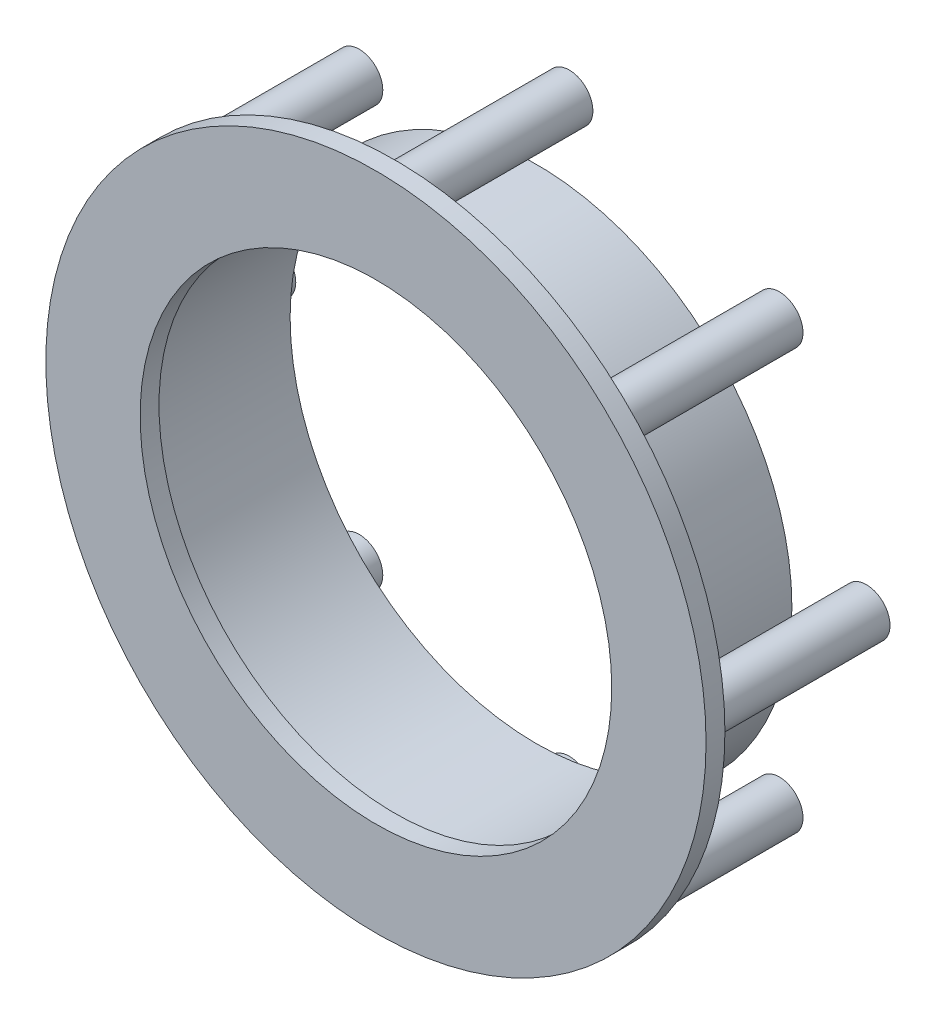
from build123d import *

# Parameters (mm, degrees)
CROQUIS1_R              = 35
CROQUIS1_R_2            = 25
SALIENTE_EXTRUIR1_DEPTH = 2
CROQUIS2_R              = 27.1
CROQUIS2_R_2            = 26.1
SALIENTE_EXTRUIR3_DEPTH = 15
CROQUIS5_R              = 2.5
SALIENTE_EXTRUIR5_DEPTH = 18.5


with BuildPart() as part:
    # Croquis1 → Saliente-Extruir1 (new body)
    with BuildSketch(Plane.XY):
        Circle(CROQUIS1_R)
        Circle(CROQUIS1_R_2, mode=Mode.SUBTRACT)
    extrude(amount=SALIENTE_EXTRUIR1_DEPTH)

    # Croquis2 → Saliente-Extruir3 (add)
    with BuildSketch(Plane(origin=(0, 0, 0), x_dir=(-1, 0, 0), z_dir=(0, 0, -1))):
        with Locations(Location((0, 0, 0), (0, 0, 180))):
            Circle(CROQUIS2_R)
        Circle(CROQUIS2_R_2, mode=Mode.SUBTRACT)
    extrude(amount=SALIENTE_EXTRUIR3_DEPTH)

    # Croquis5 → Saliente-Extruir5 (add)
    with BuildSketch(Plane(origin=(0, 0, 0), x_dir=(-1, 0, 0), z_dir=(0, 0, -1))):
        with Locations(Location((31.5, 0, 0), (0, 0, 180))):
            Circle(CROQUIS5_R)
        with Locations(Location((22.273863607, -22.273863607, 0), (0, 0, 180))):
            Circle(CROQUIS5_R)
        with Locations(Location((0, -31.5, 0), (0, 0, 180))):
            Circle(CROQUIS5_R)
        with Locations(Location((-22.273863607, -22.273863607, 0), (0, 0, 180))):
            Circle(CROQUIS5_R)
        with Locations(Location((-31.5, 0, 0), (0, 0, 180))):
            Circle(CROQUIS5_R)
        with Locations(Location((-22.273863607, 22.273863607, 0), (0, 0, 180))):
            Circle(CROQUIS5_R)
        with Locations(Location((0, 31.5, 0), (0, 0, 180))):
            Circle(CROQUIS5_R)
        with Locations(Location((22.273863607, 22.273863607, 0), (0, 0, 180))):
            Circle(CROQUIS5_R)
    extrude(amount=SALIENTE_EXTRUIR5_DEPTH)


solid = part.part
